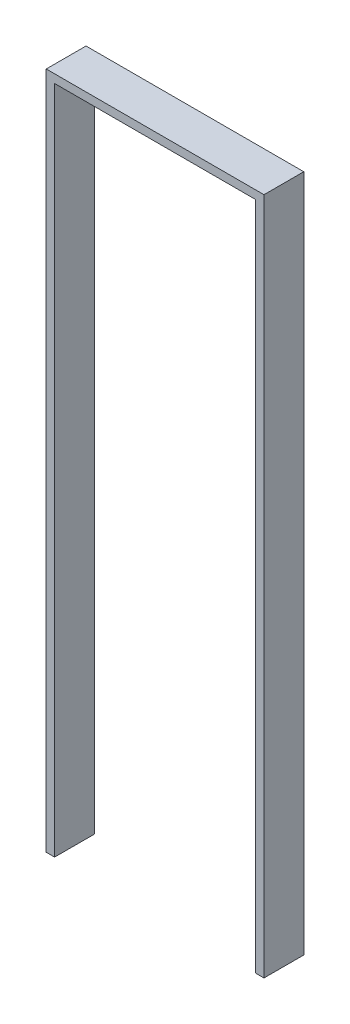
from build123d import *

# Parameters (mm, degrees)
BOSS_EXTRUDE1_DEPTH = 120.65


with BuildPart() as part:
    # Sketch1 → Boss-Extrude1 (new body)
    with BuildSketch(Plane.XY):
        Polygon((-304.8, 0), (-304.8, 2032), (304.8, 2032), (304.8, 0), (330.2, 0), (330.2, 2057.4), (-330.2, 2057.4), (-330.2, 0), align=None)
    extrude(amount=-BOSS_EXTRUDE1_DEPTH)


solid = part.part
